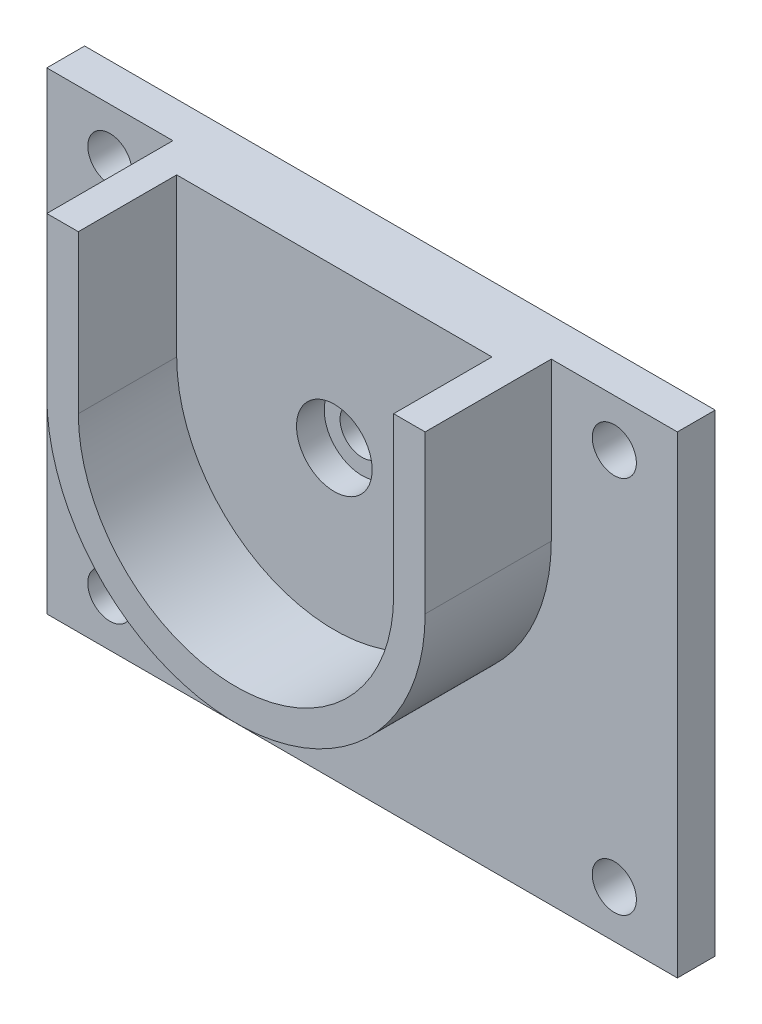
from build123d import *
from build123d.topology import SkipClean

# Parameters (mm, degrees)
SCHIZZO1_R                   = 1.75
SCHIZZO1_R_2                 = 12.5
ESTRUSIONE_ESTRUSIONE1_DEPTH = 3
ESTRUSIONE_ESTRUSIONE2_DEPTH = 10
SCHIZZO3_R                   = 3
ESTRUSIONE_ESTRUSIONE3_DEPTH = 2.2


with BuildPart() as part:
    # Schizzo1 → Estrusione-Estrusione1 (new body)
    # profile 1 of 3: a face of its own
    with SkipClean():  # the faces are left unmerged after this step: merging them gives an invalid solid
        with BuildSketch(Plane.XY):
            with BuildLine():
                Line((-8.291561976, 12.5), (-25, 12.5))
                Line((-25, 12.5), (-25, -25))
                Line((-25, -25), (25, -25))
                Line((25, -25), (25, 12.5))
                Line((25, 12.5), (8.291561976, 12.5))
                ThreePointArc((8.291561976, 12.5), (0, -15), (-8.291561976, 12.5))
            make_face()
            with Locations((-20, -21.25)):
                Circle(SCHIZZO1_R, mode=Mode.SUBTRACT)
            with Locations((20, -21.25)):
                Circle(SCHIZZO1_R, mode=Mode.SUBTRACT)
            with Locations((-20, 8.75)):
                Circle(SCHIZZO1_R, mode=Mode.SUBTRACT)
            with Locations((20, 8.75)):
                Circle(SCHIZZO1_R, mode=Mode.SUBTRACT)
        # profile 2 of 3: a face of its own
        with BuildSketch(Plane.XY):
            with BuildLine():
                Line((-4.8e-08, 12.5), (-8.291561976, 12.5))
                ThreePointArc((-8.291561976, 12.5), (0, -15), (8.291561976, 12.5))
                Line((8.291561976, 12.5), (-4.8e-08, 12.5))
            make_face()
            with BuildLine():
                ThreePointArc((12.5, 0), (-8.838834748, -8.838834782), (-4.8e-08, 12.5))
                ThreePointArc((-4.8e-08, 12.5), (8.838834748, 8.838834782), (12.5, 0))
            make_face(mode=Mode.SUBTRACT)
        # profile 3 of 3: a face of its own
        with BuildSketch(Plane.XY):
            Circle(SCHIZZO1_R_2)
            Circle(SCHIZZO1_R, mode=Mode.SUBTRACT)
        extrude(amount=ESTRUSIONE_ESTRUSIONE1_DEPTH)

    # Schizzo2 → Estrusione-Estrusione2 (add)
    with BuildSketch(Plane.XY.offset(3)):
        with BuildLine():
            Line((15, 0), (15, 12.5))
            Line((15, 12.5), (12.5, 12.5))
            Line((12.5, 12.5), (12.5, 0))
            ThreePointArc((12.5, 0), (0, -12.5), (-12.5, 0))
            Line((-12.5, 0), (-12.5, 12.5))
            Line((-12.5, 12.5), (-15, 12.5))
            Line((-15, 12.5), (-15, 0))
            ThreePointArc((-15, 0), (0, -15), (15, 0))
        make_face()
    extrude(amount=ESTRUSIONE_ESTRUSIONE2_DEPTH)

    # Schizzo3 → Estrusione-Estrusione3 (add)
    with BuildSketch(Plane.XY.offset(3)):
        with BuildLine():
            Line((12.5, 0), (12.5, 12.5))
            Line((12.5, 12.5), (-12.5, 12.5))
            Line((-12.5, 12.5), (-12.5, 0))
            ThreePointArc((-12.5, 0), (0, -12.5), (12.5, 0))
        make_face()
        Circle(SCHIZZO3_R, mode=Mode.SUBTRACT)
    extrude(amount=ESTRUSIONE_ESTRUSIONE3_DEPTH)


solid = part.part
